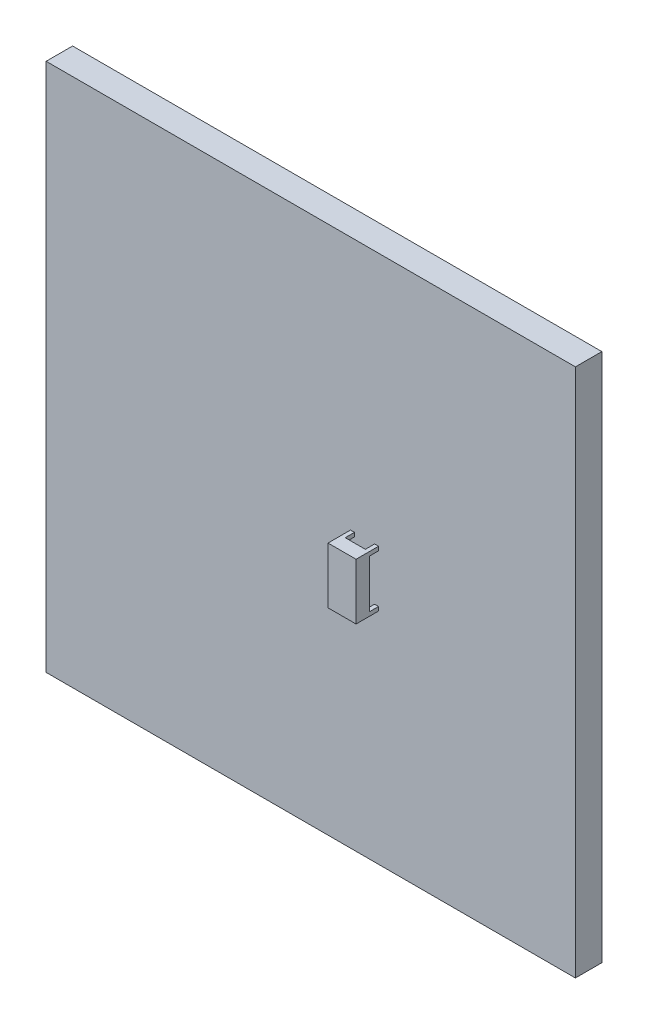
from build123d import *

# Parameters (mm, degrees)
SKETCH2_W           = 20000
SKETCH2_H           = 20000
BOSS_EXTRUDE1_DEPTH = 1000
SKETCH6_W           = 1060.125212232
SKETCH6_H           = 2120.250424464
BOSS_EXTRUDE2_DEPTH = 500
BOSS_EXTRUDE3_REACH = 14208.425
SKETCH7_W           = 150
SKETCH7_H           = 150


with BuildPart() as part:
    # Sketch2 → Boss-Extrude1 (new body)
    with BuildSketch(Plane.XY):
        Rectangle(SKETCH2_W, SKETCH2_H)
    extrude(amount=-BOSS_EXTRUDE1_DEPTH)

    # Sketch7 → Boss-Extrude3 (add, up to next)
    with BuildSketch(Plane(origin=(0, 0, 350), x_dir=(-1, 0, 0), z_dir=(0, 0, -1)), mode=Mode.PRIVATE) as boss_extrude3_sk1:
        with Locations((-2486.969262894, 335.125212232)):
            Rectangle(SKETCH7_W, SKETCH7_H)
    boss_extrude3_tool1 = extrude(boss_extrude3_sk1.sketch, amount=BOSS_EXTRUDE3_REACH, mode=Mode.PRIVATE) - part.part
    # Sketch7 → Boss-Extrude3 (add, up to next)
    with BuildSketch(Plane(origin=(0, 0, 350), x_dir=(-1, 0, 0), z_dir=(0, 0, -1)), mode=Mode.PRIVATE) as boss_extrude3_sk2:
        with Locations((-1576.844050662, 335.125212232)):
            Rectangle(SKETCH7_W, SKETCH7_H)
    boss_extrude3_tool2 = extrude(boss_extrude3_sk2.sketch, amount=BOSS_EXTRUDE3_REACH, mode=Mode.PRIVATE) - part.part
    # Sketch7 → Boss-Extrude3 (add, up to next)
    with BuildSketch(Plane(origin=(0, 0, 350), x_dir=(-1, 0, 0), z_dir=(0, 0, -1)), mode=Mode.PRIVATE) as boss_extrude3_sk3:
        with Locations((-2486.969262894, -1635.125212232)):
            Rectangle(SKETCH7_W, SKETCH7_H)
    boss_extrude3_tool3 = extrude(boss_extrude3_sk3.sketch, amount=BOSS_EXTRUDE3_REACH, mode=Mode.PRIVATE) - part.part
    # Sketch7 → Boss-Extrude3 (add, up to next)
    with BuildSketch(Plane(origin=(0, 0, 350), x_dir=(-1, 0, 0), z_dir=(0, 0, -1)), mode=Mode.PRIVATE) as boss_extrude3_sk4:
        with Locations((-1576.844050662, -1635.125212232)):
            Rectangle(SKETCH7_W, SKETCH7_H)
    boss_extrude3_tool4 = extrude(boss_extrude3_sk4.sketch, amount=BOSS_EXTRUDE3_REACH, mode=Mode.PRIVATE) - part.part


with BuildPart() as body_2:
    # Sketch6 → Boss-Extrude2 (new body)
    with BuildSketch(Plane(origin=(0, -650, 350), x_dir=(1, 0, 0), z_dir=(0, 0, 1))):
        with Locations((2031.906656778, 0)):
            Rectangle(SKETCH6_W, SKETCH6_H)
    extrude(amount=BOSS_EXTRUDE2_DEPTH)


with BuildPart() as part_1:
    add(part.part)

    add(body_2.part)  # Boss-Extrude3 merges body 2
    add(boss_extrude3_tool1.solids().sort_by_distance((2486.969263, 335.125212, 350))[0])
    add(boss_extrude3_tool2.solids().sort_by_distance((1576.844051, 335.125212, 350))[0])
    add(boss_extrude3_tool3.solids().sort_by_distance((2486.969263, -1635.125212, 350))[0])
    add(boss_extrude3_tool4.solids().sort_by_distance((1576.844051, -1635.125212, 350))[0])


solid = part_1.part
